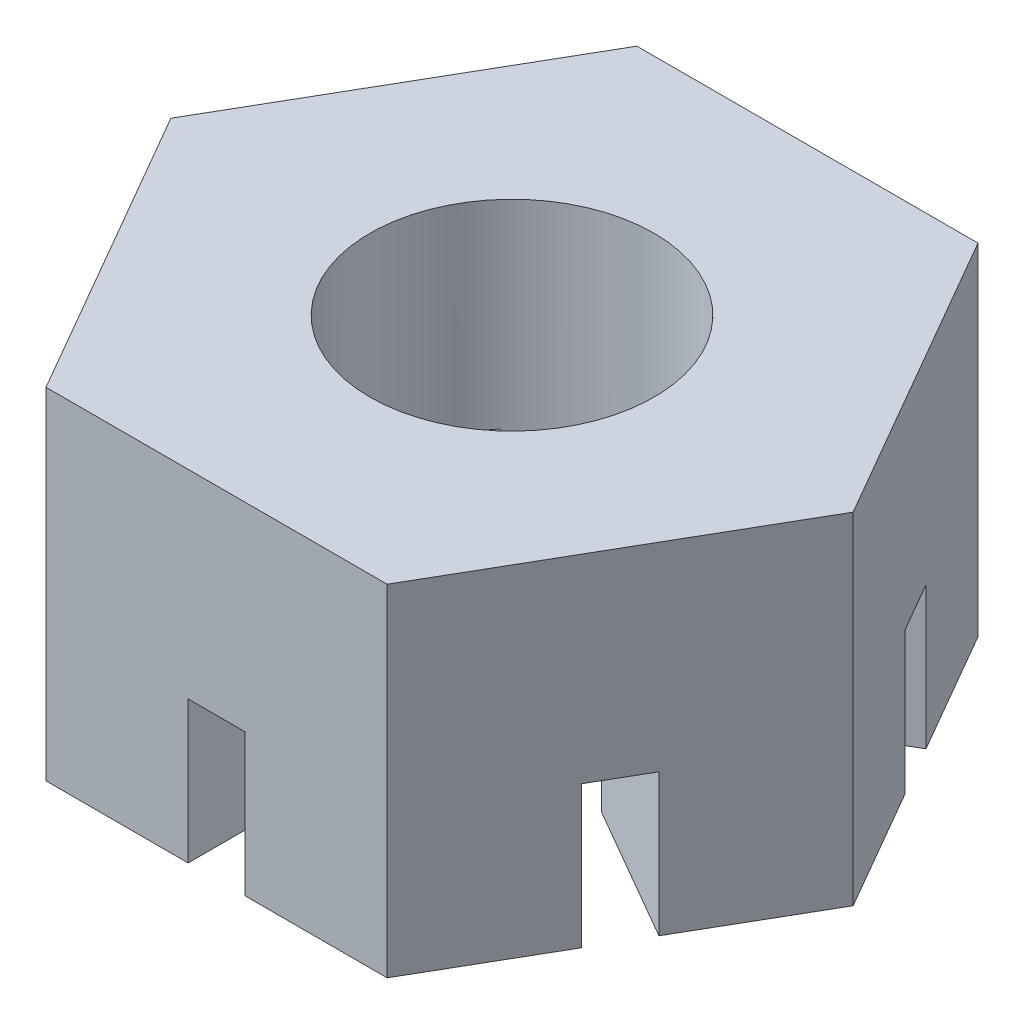
from build123d import *

# Parameters (mm, degrees)
SKETCH1_R           = 25
BOSS_EXTRUDE1_DEPTH = 60
CUT_EXTRUDE1_DEPTH  = 25


with BuildPart() as part:
    # Sketch1 → Boss-Extrude1 (new body)
    with BuildSketch(Plane(origin=(0, 0, 0), x_dir=(1, 0, 0), z_dir=(0, 1, 0))):
        Polygon((30.022213998, -52), (60.044427996, 0), (30.022213998, 52), (-30.022213998, 52), (-60.044427996, 0), (-30.022213998, -52), align=None)
        Circle(SKETCH1_R, mode=Mode.SUBTRACT)
    extrude(amount=BOSS_EXTRUDE1_DEPTH)

    # Sketch1<4> → Cut-Extrude1 (cut)
    with BuildSketch(Plane(origin=(0, 0, 0), x_dir=(1, 0, 0), z_dir=(0, 1, 0))):
        with BuildLine():
            Line((18.713203436, -16.577575733), (42.533320997, -30.330127019))
            Line((42.533320997, -30.330127019), (47.533320997, -21.669872981))
            Line((47.533320997, -21.669872981), (23.713203436, -7.917321695))
            ThreePointArc((23.713203436, -7.917321695), (21.650635095, -12.5), (18.713203436, -16.577575733))
        make_face()
        with BuildLine():
            Line((-5, -52), (5, -52))
            Line((5, -52), (5, -24.494897428))
            ThreePointArc((5, -24.494897428), (0, -25), (-5, -24.494897428))
            Line((-5, -24.494897428), (-5, -52))
        make_face()
        with BuildLine():
            Line((23.713203436, 7.917321695), (47.533320997, 21.669872981))
            Line((47.533320997, 21.669872981), (42.533320997, 30.330127019))
            Line((42.533320997, 30.330127019), (18.713203436, 16.577575733))
            ThreePointArc((18.713203436, 16.577575733), (21.650635095, 12.5), (23.713203436, 7.917321695))
        make_face()
        with BuildLine():
            Line((-47.533320997, -21.669872981), (-42.533320997, -30.330127019))
            Line((-42.533320997, -30.330127019), (-18.713203436, -16.577575733))
            ThreePointArc((-18.713203436, -16.577575733), (-21.650635095, -12.5), (-23.713203436, -7.917321695))
            Line((-23.713203436, -7.917321695), (-47.533320997, -21.669872981))
        make_face()
        with BuildLine():
            Line((-47.533320997, 21.669872981), (-23.713203436, 7.917321695))
            ThreePointArc((-23.713203436, 7.917321695), (-21.650635095, 12.5), (-18.713203436, 16.577575733))
            Line((-18.713203436, 16.577575733), (-42.533320997, 30.330127019))
            Line((-42.533320997, 30.330127019), (-47.533320997, 21.669872981))
        make_face()
        with BuildLine():
            Line((5, 24.494897428), (5, 52))
            Line((5, 52), (-5, 52))
            Line((-5, 52), (-5, 24.494897428))
            ThreePointArc((-5, 24.494897428), (0, 25), (5, 24.494897428))
        make_face()
    extrude(amount=CUT_EXTRUDE1_DEPTH, mode=Mode.SUBTRACT)


solid = part.part
